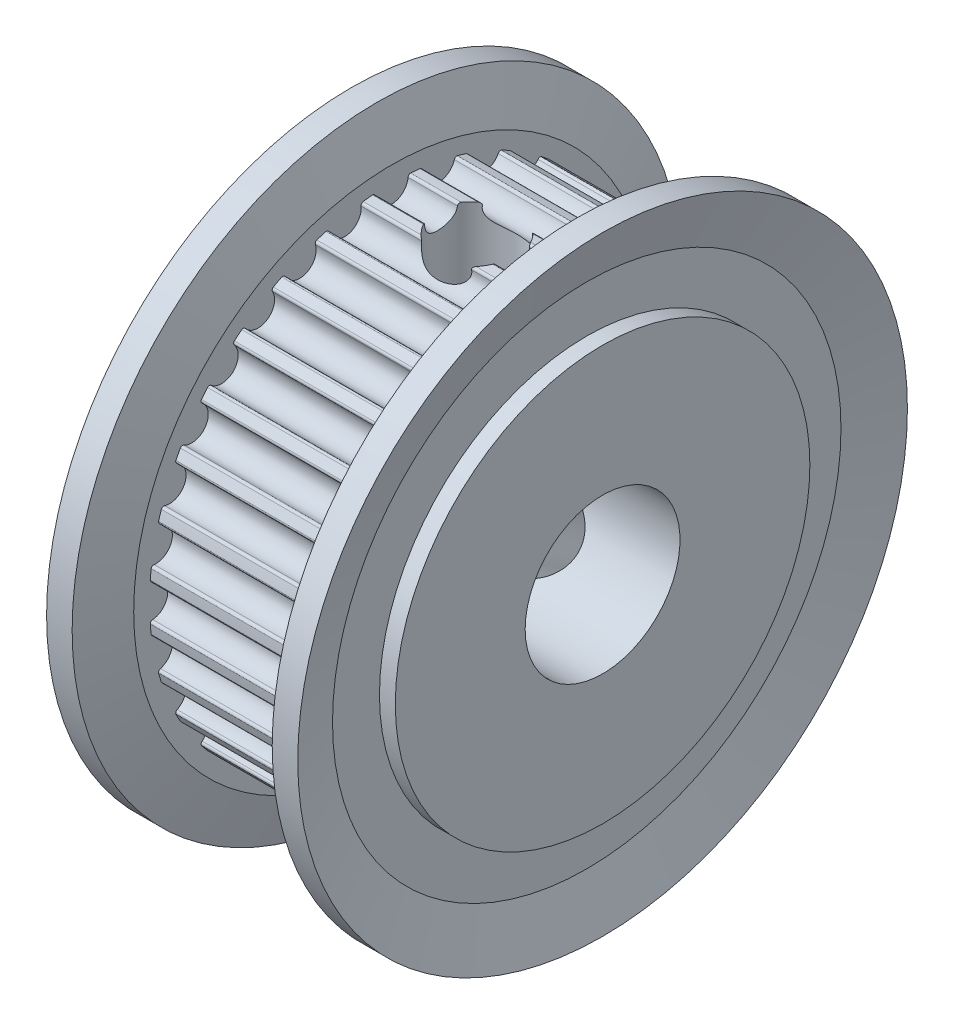
from build123d import *

# Parameters (mm, degrees)
CUT_EXTRUDE1_DEPTH       = 3.5
CUT_EXTRUDE1_DEPTH_BACK  = 3.5
CUT_EXTRUDE2_DEPTH       = 3.5
CUT_EXTRUDE2_DEPTH_BACK  = 3.5
CUT_EXTRUDE3_DEPTH       = 3.5
CUT_EXTRUDE3_DEPTH_BACK  = 3.5
CUT_EXTRUDE4_DEPTH       = 3.5
CUT_EXTRUDE4_DEPTH_BACK  = 3.5
CUT_EXTRUDE5_DEPTH       = 3.5
CUT_EXTRUDE5_DEPTH_BACK  = 3.5
CUT_EXTRUDE6_DEPTH       = 3.5
CUT_EXTRUDE6_DEPTH_BACK  = 3.5
CUT_EXTRUDE7_DEPTH       = 3.5
CUT_EXTRUDE7_DEPTH_BACK  = 3.5
CUT_EXTRUDE8_DEPTH       = 3.5
CUT_EXTRUDE8_DEPTH_BACK  = 3.5
CUT_EXTRUDE9_DEPTH       = 3.5
CUT_EXTRUDE9_DEPTH_BACK  = 3.5
CUT_EXTRUDE10_DEPTH      = 3.5
CUT_EXTRUDE10_DEPTH_BACK = 3.5
CUT_EXTRUDE11_DEPTH      = 3.5
CUT_EXTRUDE11_DEPTH_BACK = 3.5
CUT_EXTRUDE12_DEPTH      = 3.5
CUT_EXTRUDE12_DEPTH_BACK = 3.5
CUT_EXTRUDE13_DEPTH      = 3.5
CUT_EXTRUDE13_DEPTH_BACK = 3.5
CUT_EXTRUDE14_DEPTH      = 3.5
CUT_EXTRUDE14_DEPTH_BACK = 3.5
CUT_EXTRUDE15_DEPTH      = 3.5
CUT_EXTRUDE15_DEPTH_BACK = 3.5
CUT_EXTRUDE16_DEPTH      = 3.5
CUT_EXTRUDE16_DEPTH_BACK = 3.5
CUT_EXTRUDE17_DEPTH      = 3.5
CUT_EXTRUDE17_DEPTH_BACK = 3.5
CUT_EXTRUDE18_DEPTH      = 3.5
CUT_EXTRUDE18_DEPTH_BACK = 3.5
CUT_EXTRUDE19_DEPTH      = 3.5
CUT_EXTRUDE19_DEPTH_BACK = 3.5
CUT_EXTRUDE20_DEPTH      = 3.5
CUT_EXTRUDE20_DEPTH_BACK = 3.5
CUT_EXTRUDE21_DEPTH      = 3.5
CUT_EXTRUDE21_DEPTH_BACK = 3.5
CUT_EXTRUDE22_DEPTH      = 3.5
CUT_EXTRUDE22_DEPTH_BACK = 3.5
CUT_EXTRUDE23_DEPTH      = 3.5
CUT_EXTRUDE23_DEPTH_BACK = 3.5
CUT_EXTRUDE24_DEPTH      = 3.5
CUT_EXTRUDE24_DEPTH_BACK = 3.5
CUT_EXTRUDE25_DEPTH      = 3.5
CUT_EXTRUDE25_DEPTH_BACK = 3.5
CUT_EXTRUDE26_DEPTH      = 3.5
CUT_EXTRUDE26_DEPTH_BACK = 3.5
CUT_EXTRUDE27_DEPTH      = 3.5
CUT_EXTRUDE27_DEPTH_BACK = 3.5
CUT_EXTRUDE28_DEPTH      = 3.5
CUT_EXTRUDE28_DEPTH_BACK = 3.5
CUT_EXTRUDE29_DEPTH      = 3.5
CUT_EXTRUDE29_DEPTH_BACK = 3.5
CUT_EXTRUDE30_DEPTH      = 3.5
CUT_EXTRUDE30_DEPTH_BACK = 3.5
CUT_EXTRUDE31_DEPTH      = 3.5
CUT_EXTRUDE31_DEPTH_BACK = 3.5
CUT_EXTRUDE32_DEPTH      = 3.5
CUT_EXTRUDE32_DEPTH_BACK = 3.5
SKETCH36_W               = 10.3
SKETCH36_H               = 3.175
SKETCH37_W               = 1.621
SKETCH37_H               = 9.93


with BuildPart() as part:
    # Sketch1 → Revolve1 (revolve)
    with BuildSketch(Plane.XY, mode=Mode.PRIVATE) as revolve1_sk:
        Polygon((-5.15, 0), (-5.15, 8.5), (-3.5, 8.5), (-3.5, 9.93), (3.5, 9.93), (3.5, 8.5), (5.15, 8.5), (5.15, 0), align=None)
    revolve(revolve1_sk.sketch.rotate(Axis((5.15, 0, 0), (-1, 0, 0)), 270), axis=Axis((5.15, 0, 0), (-1, 0, 0)))

    # Sketch2 → Cut-Extrude1 (cut, two sides: drawn at the far end of the back side and taken through both)
    with BuildSketch(Plane(origin=(0, 0, 0), x_dir=(0, 0, -1), z_dir=(1, 0, 0)).offset(-CUT_EXTRUDE1_DEPTH_BACK)):
        with BuildLine():
            Line((-0.950908352, 10.140512724), (-0.927279331, 9.888532197))
            Line((-0.927279331, 9.888532197), (-0.792969158, 9.89929093))
            ThreePointArc((-0.792969158, 9.89929093), (-0.711706778, 9.873169891), (-0.672449407, 9.797375816))
            ThreePointArc((-0.672449407, 9.797375816), (-2e-09, 9.181), (0.672449407, 9.797375812))
            ThreePointArc((0.672449407, 9.797375812), (0.711706777, 9.87316989), (0.792969158, 9.89929093))
            Line((0.792969158, 9.89929093), (0.927279331, 9.888532197))
            Line((0.927279331, 9.888532197), (0.950908352, 10.140512724))
            ThreePointArc((0.950908352, 10.140512724), (0, 10.185), (-0.950908352, 10.140512724))
        make_face()
    extrude(amount=CUT_EXTRUDE1_DEPTH + CUT_EXTRUDE1_DEPTH_BACK, mode=Mode.SUBTRACT)

    # Sketch3 → Cut-Extrude2 (cut, two sides: drawn at the far end of the back side and taken through both)
    with BuildSketch(Plane(origin=(0, 0, 0), x_dir=(0, 0, -1), z_dir=(1, 0, 0)).offset(-CUT_EXTRUDE2_DEPTH_BACK)):
        with BuildLine():
            Line((-2.910952807, 9.760152599), (-2.838618849, 9.5176236))
            Line((-2.838618849, 9.5176236), (-2.708988333, 9.554378222))
            ThreePointArc((-2.708988333, 9.554378222), (-2.624191426, 9.544612596), (-2.570901683, 9.477933616))
            ThreePointArc((-2.570901683, 9.477933616), (-1.791124249, 9.004589659), (-1.251844722, 9.740310354))
            ThreePointArc((-1.251844722, 9.740310354), (-1.228128363, 9.822306803), (-1.153523377, 9.863779439))
            Line((-1.153523377, 9.863779439), (-1.019695012, 9.879430047))
            Line((-1.019695012, 9.879430047), (-1.045678978, 10.131178632))
            ThreePointArc((-1.045678978, 10.131178632), (-1.98699493, 9.989298081), (-2.910952807, 9.760152599))
        make_face()
    extrude(amount=CUT_EXTRUDE2_DEPTH + CUT_EXTRUDE2_DEPTH_BACK, mode=Mode.SUBTRACT)

    # Sketch4 → Cut-Extrude3 (cut, two sides: drawn at the far end of the back side and taken through both)
    with BuildSketch(Plane(origin=(0, 0, 0), x_dir=(0, 0, -1), z_dir=(1, 0, 0)).offset(-CUT_EXTRUDE3_DEPTH_BACK)):
        with BuildLine():
            Line((-4.759130979, 9.004715283), (-4.640871837, 8.780958066))
            Line((-4.640871837, 8.780958066), (-4.520902606, 8.842296117))
            ThreePointArc((-4.520902606, 8.842296117), (-4.435829868, 8.849261191), (-4.370555649, 8.794259742))
            ThreePointArc((-4.370555649, 8.794259742), (-3.513416595, 8.482137987), (-3.12803116, 9.308930232))
            ThreePointArc((-3.12803116, 9.308930232), (-3.120767218, 9.393977974), (-3.055686656, 9.449208436))
            Line((-3.055686656, 9.449208436), (-2.927483047, 9.490666941))
            Line((-2.927483047, 9.490666941), (-3.002081451, 9.732509027))
            ThreePointArc((-3.002081451, 9.732509027), (-3.897630759, 9.409713039), (-4.759130979, 9.004715283))
        make_face()
    extrude(amount=CUT_EXTRUDE3_DEPTH + CUT_EXTRUDE3_DEPTH_BACK, mode=Mode.SUBTRACT)

    # Sketch5 → Cut-Extrude4 (cut, two sides: drawn at the far end of the back side and taken through both)
    with BuildSketch(Plane(origin=(0, 0, 0), x_dir=(0, 0, -1), z_dir=(1, 0, 0)).offset(-CUT_EXTRUDE4_DEPTH_BACK)):
        with BuildLine():
            Line((-6.424418416, 7.903231808), (-6.264778723, 7.706845238))
            Line((-6.264778723, 7.706845238), (-6.159081127, 7.790409532))
            ThreePointArc((-6.159081127, 7.790409532), (-6.077001856, 7.813837641), (-6.002251613, 7.772627398))
            ThreePointArc((-6.002251613, 7.772627398), (-5.100690311, 7.633722509), (-4.884009115, 8.519813141))
            ThreePointArc((-4.884009115, 8.519813141), (-4.893476739, 8.60464384), (-4.84042161, 8.671509651))
            Line((-4.84042161, 8.671509651), (-4.722769551, 8.737182826))
            Line((-4.722769551, 8.737182826), (-4.843115618, 8.959824558))
            ThreePointArc((-4.843115618, 8.959824558), (-5.658482823, 8.468518001), (-6.424418416, 7.903231808))
        make_face()
    extrude(amount=CUT_EXTRUDE4_DEPTH + CUT_EXTRUDE4_DEPTH_BACK, mode=Mode.SUBTRACT)

    # Sketch6 → Cut-Extrude5 (cut, two sides: drawn at the far end of the back side and taken through both)
    with BuildSketch(Plane(origin=(0, 0, 0), x_dir=(0, 0, -1), z_dir=(1, 0, 0)).offset(-CUT_EXTRUDE5_DEPTH_BACK)):
        with BuildLine():
            Line((-7.842819056, 6.498031568), (-7.647933676, 6.33656267))
            Line((-7.647933676, 6.33656267), (-7.560569614, 6.439141876))
            ThreePointArc((-7.560569614, 6.439141876), (-7.484638071, 6.478132693), (-7.403284413, 6.452297342))
            ThreePointArc((-7.403284413, 6.452297342), (-6.49194736, 6.491947357), (-6.452297339, 7.40328441))
            ThreePointArc((-6.452297339, 7.40328441), (-6.478132693, 7.484638069), (-6.439141876, 7.560569614))
            Line((-6.439141876, 7.560569614), (-6.33656267, 7.647933676))
            Line((-6.33656267, 7.647933676), (-6.498031568, 7.842819056))
            ThreePointArc((-6.498031568, 7.842819056), (-7.201882566, 7.201882566), (-7.842819056, 6.498031568))
        make_face()
    extrude(amount=CUT_EXTRUDE5_DEPTH + CUT_EXTRUDE5_DEPTH_BACK, mode=Mode.SUBTRACT)

    # Sketch7 → Cut-Extrude6 (cut, two sides: drawn at the far end of the back side and taken through both)
    with BuildSketch(Plane(origin=(0, 0, 0), x_dir=(0, 0, -1), z_dir=(1, 0, 0)).offset(-CUT_EXTRUDE6_DEPTH_BACK)):
        with BuildLine():
            Line((-8.959824558, 4.843115618), (-8.737182826, 4.722769551))
            Line((-8.737182826, 4.722769551), (-8.671509651, 4.84042161))
            ThreePointArc((-8.671509651, 4.84042161), (-8.604643842, 4.893476738), (-8.519813145, 4.884009117))
            ThreePointArc((-8.519813145, 4.884009117), (-7.633722512, 5.100690308), (-7.772627394, 6.00225161))
            ThreePointArc((-7.772627394, 6.00225161), (-7.813837641, 6.077001854), (-7.790409532, 6.159081127))
            Line((-7.790409532, 6.159081127), (-7.706845238, 6.264778723))
            Line((-7.706845238, 6.264778723), (-7.903231808, 6.424418416))
            ThreePointArc((-7.903231808, 6.424418416), (-8.468518001, 5.658482823), (-8.959824558, 4.843115618))
        make_face()
    extrude(amount=CUT_EXTRUDE6_DEPTH + CUT_EXTRUDE6_DEPTH_BACK, mode=Mode.SUBTRACT)

    # Sketch8 → Cut-Extrude7 (cut, two sides: drawn at the far end of the back side and taken through both)
    with BuildSketch(Plane(origin=(0, 0, 0), x_dir=(0, 0, -1), z_dir=(1, 0, 0)).offset(-CUT_EXTRUDE7_DEPTH_BACK)):
        with BuildLine():
            Line((-9.732509027, 3.002081451), (-9.490666941, 2.927483047))
            Line((-9.490666941, 2.927483047), (-9.449208436, 3.055686656))
            ThreePointArc((-9.449208436, 3.055686656), (-9.393977976, 3.120767217), (-9.308930236, 3.128031162))
            ThreePointArc((-9.308930236, 3.128031162), (-8.482137989, 3.513416591), (-8.794259738, 4.370555647))
            ThreePointArc((-8.794259738, 4.370555647), (-8.84926119, 4.435829866), (-8.842296117, 4.520902606))
            Line((-8.842296117, 4.520902606), (-8.780958066, 4.640871837))
            Line((-8.780958066, 4.640871837), (-9.004715283, 4.759130979))
            ThreePointArc((-9.004715283, 4.759130979), (-9.409713039, 3.897630759), (-9.732509027, 3.002081451))
        make_face()
    extrude(amount=CUT_EXTRUDE7_DEPTH + CUT_EXTRUDE7_DEPTH_BACK, mode=Mode.SUBTRACT)

    # Sketch9 → Cut-Extrude8 (cut, two sides: drawn at the far end of the back side and taken through both)
    with BuildSketch(Plane(origin=(0, 0, 0), x_dir=(0, 0, -1), z_dir=(1, 0, 0)).offset(-CUT_EXTRUDE8_DEPTH_BACK)):
        with BuildLine():
            Line((-10.131178632, 1.045678978), (-9.879430047, 1.019695012))
            Line((-9.879430047, 1.019695012), (-9.863779439, 1.153523377))
            ThreePointArc((-9.863779439, 1.153523377), (-9.822306805, 1.228128361), (-9.740310358, 1.251844723))
            ThreePointArc((-9.740310358, 1.251844723), (-9.00458966, 1.791124244), (-9.477933611, 2.570901682))
            ThreePointArc((-9.477933611, 2.570901682), (-9.544612594, 2.624191424), (-9.554378222, 2.708988333))
            Line((-9.554378222, 2.708988333), (-9.5176236, 2.838618849))
            Line((-9.5176236, 2.838618849), (-9.760152599, 2.910952807))
            ThreePointArc((-9.760152599, 2.910952807), (-9.989298081, 1.98699493), (-10.131178632, 1.045678978))
        make_face()
    extrude(amount=CUT_EXTRUDE8_DEPTH + CUT_EXTRUDE8_DEPTH_BACK, mode=Mode.SUBTRACT)

    # Sketch10 → Cut-Extrude9 (cut, two sides: drawn at the far end of the back side and taken through both)
    with BuildSketch(Plane(origin=(0, 0, 0), x_dir=(0, 0, -1), z_dir=(1, 0, 0)).offset(-CUT_EXTRUDE9_DEPTH_BACK)):
        with BuildLine():
            Line((-10.140512724, -0.950908352), (-9.888532197, -0.927279331))
            Line((-9.888532197, -0.927279331), (-9.89929093, -0.792969158))
            ThreePointArc((-9.89929093, -0.792969158), (-9.873169891, -0.711706778), (-9.797375816, -0.672449407))
            ThreePointArc((-9.797375816, -0.672449407), (-9.181, -2e-09), (-9.797375812, 0.672449407))
            ThreePointArc((-9.797375812, 0.672449407), (-9.87316989, 0.711706777), (-9.89929093, 0.792969158))
            Line((-9.89929093, 0.792969158), (-9.888532197, 0.927279331))
            Line((-9.888532197, 0.927279331), (-10.140512724, 0.950908352))
            ThreePointArc((-10.140512724, 0.950908352), (-10.185, 0), (-10.140512724, -0.950908352))
        make_face()
    extrude(amount=CUT_EXTRUDE9_DEPTH + CUT_EXTRUDE9_DEPTH_BACK, mode=Mode.SUBTRACT)

    # Sketch11 → Cut-Extrude10 (cut, two sides: drawn at the far end of the back side and taken through both)
    with BuildSketch(Plane(origin=(0, 0, 0), x_dir=(0, 0, -1), z_dir=(1, 0, 0)).offset(-CUT_EXTRUDE10_DEPTH_BACK)):
        with BuildLine():
            Line((-9.760152599, -2.910952807), (-9.5176236, -2.838618849))
            Line((-9.5176236, -2.838618849), (-9.554378222, -2.708988333))
            ThreePointArc((-9.554378222, -2.708988333), (-9.544612596, -2.624191426), (-9.477933616, -2.570901683))
            ThreePointArc((-9.477933616, -2.570901683), (-9.004589659, -1.791124249), (-9.740310354, -1.251844722))
            ThreePointArc((-9.740310354, -1.251844722), (-9.822306803, -1.228128363), (-9.863779439, -1.153523377))
            Line((-9.863779439, -1.153523377), (-9.879430047, -1.019695012))
            Line((-9.879430047, -1.019695012), (-10.131178632, -1.045678978))
            ThreePointArc((-10.131178632, -1.045678978), (-9.989298081, -1.98699493), (-9.760152599, -2.910952807))
        make_face()
    extrude(amount=CUT_EXTRUDE10_DEPTH + CUT_EXTRUDE10_DEPTH_BACK, mode=Mode.SUBTRACT)

    # Sketch12 → Cut-Extrude11 (cut, two sides: drawn at the far end of the back side and taken through both)
    with BuildSketch(Plane(origin=(0, 0, 0), x_dir=(0, 0, -1), z_dir=(1, 0, 0)).offset(-CUT_EXTRUDE11_DEPTH_BACK)):
        with BuildLine():
            Line((-9.004715283, -4.759130979), (-8.780958066, -4.640871837))
            Line((-8.780958066, -4.640871837), (-8.842296117, -4.520902606))
            ThreePointArc((-8.842296117, -4.520902606), (-8.849261191, -4.435829868), (-8.794259742, -4.370555649))
            ThreePointArc((-8.794259742, -4.370555649), (-8.482137987, -3.513416595), (-9.308930232, -3.12803116))
            ThreePointArc((-9.308930232, -3.12803116), (-9.393977974, -3.120767218), (-9.449208436, -3.055686656))
            Line((-9.449208436, -3.055686656), (-9.490666941, -2.927483047))
            Line((-9.490666941, -2.927483047), (-9.732509027, -3.002081451))
            ThreePointArc((-9.732509027, -3.002081451), (-9.409713039, -3.897630759), (-9.004715283, -4.759130979))
        make_face()
    extrude(amount=CUT_EXTRUDE11_DEPTH + CUT_EXTRUDE11_DEPTH_BACK, mode=Mode.SUBTRACT)

    # Sketch13 → Cut-Extrude12 (cut, two sides: drawn at the far end of the back side and taken through both)
    with BuildSketch(Plane(origin=(0, 0, 0), x_dir=(0, 0, -1), z_dir=(1, 0, 0)).offset(-CUT_EXTRUDE12_DEPTH_BACK)):
        with BuildLine():
            Line((-7.903231808, -6.424418416), (-7.706845238, -6.264778723))
            Line((-7.706845238, -6.264778723), (-7.790409532, -6.159081127))
            ThreePointArc((-7.790409532, -6.159081127), (-7.813837641, -6.077001856), (-7.772627398, -6.002251613))
            ThreePointArc((-7.772627398, -6.002251613), (-7.633722509, -5.100690311), (-8.519813141, -4.884009115))
            ThreePointArc((-8.519813141, -4.884009115), (-8.60464384, -4.893476739), (-8.671509651, -4.84042161))
            Line((-8.671509651, -4.84042161), (-8.737182826, -4.722769551))
            Line((-8.737182826, -4.722769551), (-8.959824558, -4.843115618))
            ThreePointArc((-8.959824558, -4.843115618), (-8.468518001, -5.658482823), (-7.903231808, -6.424418416))
        make_face()
    extrude(amount=CUT_EXTRUDE12_DEPTH + CUT_EXTRUDE12_DEPTH_BACK, mode=Mode.SUBTRACT)

    # Sketch14 → Cut-Extrude13 (cut, two sides: drawn at the far end of the back side and taken through both)
    with BuildSketch(Plane(origin=(0, 0, 0), x_dir=(0, 0, -1), z_dir=(1, 0, 0)).offset(-CUT_EXTRUDE13_DEPTH_BACK)):
        with BuildLine():
            Line((-6.498031568, -7.842819056), (-6.33656267, -7.647933676))
            Line((-6.33656267, -7.647933676), (-6.439141876, -7.560569614))
            ThreePointArc((-6.439141876, -7.560569614), (-6.478132693, -7.484638071), (-6.452297342, -7.403284413))
            ThreePointArc((-6.452297342, -7.403284413), (-6.491947357, -6.49194736), (-7.40328441, -6.452297339))
            ThreePointArc((-7.40328441, -6.452297339), (-7.484638069, -6.478132693), (-7.560569614, -6.439141876))
            Line((-7.560569614, -6.439141876), (-7.647933676, -6.33656267))
            Line((-7.647933676, -6.33656267), (-7.842819056, -6.498031568))
            ThreePointArc((-7.842819056, -6.498031568), (-7.201882566, -7.201882566), (-6.498031568, -7.842819056))
        make_face()
    extrude(amount=CUT_EXTRUDE13_DEPTH + CUT_EXTRUDE13_DEPTH_BACK, mode=Mode.SUBTRACT)

    # Sketch15 → Cut-Extrude14 (cut, two sides: drawn at the far end of the back side and taken through both)
    with BuildSketch(Plane(origin=(0, 0, 0), x_dir=(0, 0, -1), z_dir=(1, 0, 0)).offset(-CUT_EXTRUDE14_DEPTH_BACK)):
        with BuildLine():
            Line((-4.843115618, -8.959824558), (-4.722769551, -8.737182826))
            Line((-4.722769551, -8.737182826), (-4.84042161, -8.671509651))
            ThreePointArc((-4.84042161, -8.671509651), (-4.893476738, -8.604643842), (-4.884009117, -8.519813145))
            ThreePointArc((-4.884009117, -8.519813145), (-5.100690308, -7.633722512), (-6.00225161, -7.772627394))
            ThreePointArc((-6.00225161, -7.772627394), (-6.077001854, -7.813837641), (-6.159081127, -7.790409532))
            Line((-6.159081127, -7.790409532), (-6.264778723, -7.706845238))
            Line((-6.264778723, -7.706845238), (-6.424418416, -7.903231808))
            ThreePointArc((-6.424418416, -7.903231808), (-5.658482823, -8.468518001), (-4.843115618, -8.959824558))
        make_face()
    extrude(amount=CUT_EXTRUDE14_DEPTH + CUT_EXTRUDE14_DEPTH_BACK, mode=Mode.SUBTRACT)

    # Sketch16 → Cut-Extrude15 (cut, two sides: drawn at the far end of the back side and taken through both)
    with BuildSketch(Plane(origin=(0, 0, 0), x_dir=(0, 0, -1), z_dir=(1, 0, 0)).offset(-CUT_EXTRUDE15_DEPTH_BACK)):
        with BuildLine():
            Line((-3.002081451, -9.732509027), (-2.927483047, -9.490666941))
            Line((-2.927483047, -9.490666941), (-3.055686656, -9.449208436))
            ThreePointArc((-3.055686656, -9.449208436), (-3.120767217, -9.393977976), (-3.128031162, -9.308930236))
            ThreePointArc((-3.128031162, -9.308930236), (-3.513416591, -8.482137989), (-4.370555647, -8.794259738))
            ThreePointArc((-4.370555647, -8.794259738), (-4.435829866, -8.84926119), (-4.520902606, -8.842296117))
            Line((-4.520902606, -8.842296117), (-4.640871837, -8.780958066))
            Line((-4.640871837, -8.780958066), (-4.759130979, -9.004715283))
            ThreePointArc((-4.759130979, -9.004715283), (-3.897630759, -9.409713039), (-3.002081451, -9.732509027))
        make_face()
    extrude(amount=CUT_EXTRUDE15_DEPTH + CUT_EXTRUDE15_DEPTH_BACK, mode=Mode.SUBTRACT)

    # Sketch17 → Cut-Extrude16 (cut, two sides: drawn at the far end of the back side and taken through both)
    with BuildSketch(Plane(origin=(0, 0, 0), x_dir=(0, 0, -1), z_dir=(1, 0, 0)).offset(-CUT_EXTRUDE16_DEPTH_BACK)):
        with BuildLine():
            Line((-1.045678978, -10.131178632), (-1.019695012, -9.879430047))
            Line((-1.019695012, -9.879430047), (-1.153523377, -9.863779439))
            ThreePointArc((-1.153523377, -9.863779439), (-1.228128361, -9.822306805), (-1.251844723, -9.740310358))
            ThreePointArc((-1.251844723, -9.740310358), (-1.791124244, -9.00458966), (-2.570901682, -9.477933611))
            ThreePointArc((-2.570901682, -9.477933611), (-2.624191424, -9.544612594), (-2.708988333, -9.554378222))
            Line((-2.708988333, -9.554378222), (-2.838618849, -9.5176236))
            Line((-2.838618849, -9.5176236), (-2.910952807, -9.760152599))
            ThreePointArc((-2.910952807, -9.760152599), (-1.98699493, -9.989298081), (-1.045678978, -10.131178632))
        make_face()
    extrude(amount=CUT_EXTRUDE16_DEPTH + CUT_EXTRUDE16_DEPTH_BACK, mode=Mode.SUBTRACT)

    # Sketch18 → Cut-Extrude17 (cut, two sides: drawn at the far end of the back side and taken through both)
    with BuildSketch(Plane(origin=(0, 0, 0), x_dir=(0, 0, -1), z_dir=(1, 0, 0)).offset(-CUT_EXTRUDE17_DEPTH_BACK)):
        with BuildLine():
            Line((0.950908352, -10.140512724), (0.927279331, -9.888532197))
            Line((0.927279331, -9.888532197), (0.792969158, -9.89929093))
            ThreePointArc((0.792969158, -9.89929093), (0.711706778, -9.873169891), (0.672449407, -9.797375816))
            ThreePointArc((0.672449407, -9.797375816), (2e-09, -9.181), (-0.672449407, -9.797375812))
            ThreePointArc((-0.672449407, -9.797375812), (-0.711706777, -9.87316989), (-0.792969158, -9.89929093))
            Line((-0.792969158, -9.89929093), (-0.927279331, -9.888532197))
            Line((-0.927279331, -9.888532197), (-0.950908352, -10.140512724))
            ThreePointArc((-0.950908352, -10.140512724), (0, -10.185), (0.950908352, -10.140512724))
        make_face()
    extrude(amount=CUT_EXTRUDE17_DEPTH + CUT_EXTRUDE17_DEPTH_BACK, mode=Mode.SUBTRACT)

    # Sketch19 → Cut-Extrude18 (cut, two sides: drawn at the far end of the back side and taken through both)
    with BuildSketch(Plane(origin=(0, 0, 0), x_dir=(0, 0, -1), z_dir=(1, 0, 0)).offset(-CUT_EXTRUDE18_DEPTH_BACK)):
        with BuildLine():
            Line((2.910952807, -9.760152599), (2.838618849, -9.5176236))
            Line((2.838618849, -9.5176236), (2.708988333, -9.554378222))
            ThreePointArc((2.708988333, -9.554378222), (2.624191426, -9.544612596), (2.570901683, -9.477933616))
            ThreePointArc((2.570901683, -9.477933616), (1.791124249, -9.004589659), (1.251844722, -9.740310354))
            ThreePointArc((1.251844722, -9.740310354), (1.228128363, -9.822306803), (1.153523377, -9.863779439))
            Line((1.153523377, -9.863779439), (1.019695012, -9.879430047))
            Line((1.019695012, -9.879430047), (1.045678978, -10.131178632))
            ThreePointArc((1.045678978, -10.131178632), (1.98699493, -9.989298081), (2.910952807, -9.760152599))
        make_face()
    extrude(amount=CUT_EXTRUDE18_DEPTH + CUT_EXTRUDE18_DEPTH_BACK, mode=Mode.SUBTRACT)

    # Sketch20 → Cut-Extrude19 (cut, two sides: drawn at the far end of the back side and taken through both)
    with BuildSketch(Plane(origin=(0, 0, 0), x_dir=(0, 0, -1), z_dir=(1, 0, 0)).offset(-CUT_EXTRUDE19_DEPTH_BACK)):
        with BuildLine():
            Line((4.759130979, -9.004715283), (4.640871837, -8.780958066))
            Line((4.640871837, -8.780958066), (4.520902606, -8.842296117))
            ThreePointArc((4.520902606, -8.842296117), (4.435829868, -8.849261191), (4.370555649, -8.794259742))
            ThreePointArc((4.370555649, -8.794259742), (3.513416595, -8.482137987), (3.12803116, -9.308930232))
            ThreePointArc((3.12803116, -9.308930232), (3.120767218, -9.393977974), (3.055686656, -9.449208436))
            Line((3.055686656, -9.449208436), (2.927483047, -9.490666941))
            Line((2.927483047, -9.490666941), (3.002081451, -9.732509027))
            ThreePointArc((3.002081451, -9.732509027), (3.897630759, -9.409713039), (4.759130979, -9.004715283))
        make_face()
    extrude(amount=CUT_EXTRUDE19_DEPTH + CUT_EXTRUDE19_DEPTH_BACK, mode=Mode.SUBTRACT)

    # Sketch21 → Cut-Extrude20 (cut, two sides: drawn at the far end of the back side and taken through both)
    with BuildSketch(Plane(origin=(0, 0, 0), x_dir=(0, 0, -1), z_dir=(1, 0, 0)).offset(-CUT_EXTRUDE20_DEPTH_BACK)):
        with BuildLine():
            Line((6.424418416, -7.903231808), (6.264778723, -7.706845238))
            Line((6.264778723, -7.706845238), (6.159081127, -7.790409532))
            ThreePointArc((6.159081127, -7.790409532), (6.077001856, -7.813837641), (6.002251613, -7.772627398))
            ThreePointArc((6.002251613, -7.772627398), (5.100690311, -7.633722509), (4.884009115, -8.519813141))
            ThreePointArc((4.884009115, -8.519813141), (4.893476739, -8.60464384), (4.84042161, -8.671509651))
            Line((4.84042161, -8.671509651), (4.722769551, -8.737182826))
            Line((4.722769551, -8.737182826), (4.843115618, -8.959824558))
            ThreePointArc((4.843115618, -8.959824558), (5.658482823, -8.468518001), (6.424418416, -7.903231808))
        make_face()
    extrude(amount=CUT_EXTRUDE20_DEPTH + CUT_EXTRUDE20_DEPTH_BACK, mode=Mode.SUBTRACT)

    # Sketch22 → Cut-Extrude21 (cut, two sides: drawn at the far end of the back side and taken through both)
    with BuildSketch(Plane(origin=(0, 0, 0), x_dir=(0, 0, -1), z_dir=(1, 0, 0)).offset(-CUT_EXTRUDE21_DEPTH_BACK)):
        with BuildLine():
            Line((7.842819056, -6.498031568), (7.647933676, -6.33656267))
            Line((7.647933676, -6.33656267), (7.560569614, -6.439141876))
            ThreePointArc((7.560569614, -6.439141876), (7.484638071, -6.478132693), (7.403284413, -6.452297342))
            ThreePointArc((7.403284413, -6.452297342), (6.49194736, -6.491947357), (6.452297339, -7.40328441))
            ThreePointArc((6.452297339, -7.40328441), (6.478132693, -7.484638069), (6.439141876, -7.560569614))
            Line((6.439141876, -7.560569614), (6.33656267, -7.647933676))
            Line((6.33656267, -7.647933676), (6.498031568, -7.842819056))
            ThreePointArc((6.498031568, -7.842819056), (7.201882566, -7.201882566), (7.842819056, -6.498031568))
        make_face()
    extrude(amount=CUT_EXTRUDE21_DEPTH + CUT_EXTRUDE21_DEPTH_BACK, mode=Mode.SUBTRACT)

    # Sketch23 → Cut-Extrude22 (cut, two sides: drawn at the far end of the back side and taken through both)
    with BuildSketch(Plane(origin=(0, 0, 0), x_dir=(0, 0, -1), z_dir=(1, 0, 0)).offset(-CUT_EXTRUDE22_DEPTH_BACK)):
        with BuildLine():
            Line((8.959824558, -4.843115618), (8.737182826, -4.722769551))
            Line((8.737182826, -4.722769551), (8.671509651, -4.84042161))
            ThreePointArc((8.671509651, -4.84042161), (8.604643842, -4.893476738), (8.519813145, -4.884009117))
            ThreePointArc((8.519813145, -4.884009117), (7.633722512, -5.100690308), (7.772627394, -6.00225161))
            ThreePointArc((7.772627394, -6.00225161), (7.813837641, -6.077001854), (7.790409532, -6.159081127))
            Line((7.790409532, -6.159081127), (7.706845238, -6.264778723))
            Line((7.706845238, -6.264778723), (7.903231808, -6.424418416))
            ThreePointArc((7.903231808, -6.424418416), (8.468518001, -5.658482823), (8.959824558, -4.843115618))
        make_face()
    extrude(amount=CUT_EXTRUDE22_DEPTH + CUT_EXTRUDE22_DEPTH_BACK, mode=Mode.SUBTRACT)

    # Sketch24 → Cut-Extrude23 (cut, two sides: drawn at the far end of the back side and taken through both)
    with BuildSketch(Plane(origin=(0, 0, 0), x_dir=(0, 0, -1), z_dir=(1, 0, 0)).offset(-CUT_EXTRUDE23_DEPTH_BACK)):
        with BuildLine():
            Line((9.732509027, -3.002081451), (9.490666941, -2.927483047))
            Line((9.490666941, -2.927483047), (9.449208436, -3.055686656))
            ThreePointArc((9.449208436, -3.055686656), (9.393977976, -3.120767217), (9.308930236, -3.128031162))
            ThreePointArc((9.308930236, -3.128031162), (8.482137989, -3.513416591), (8.794259738, -4.370555647))
            ThreePointArc((8.794259738, -4.370555647), (8.84926119, -4.435829866), (8.842296117, -4.520902606))
            Line((8.842296117, -4.520902606), (8.780958066, -4.640871837))
            Line((8.780958066, -4.640871837), (9.004715283, -4.759130979))
            ThreePointArc((9.004715283, -4.759130979), (9.409713039, -3.897630759), (9.732509027, -3.002081451))
        make_face()
    extrude(amount=CUT_EXTRUDE23_DEPTH + CUT_EXTRUDE23_DEPTH_BACK, mode=Mode.SUBTRACT)

    # Sketch25 → Cut-Extrude24 (cut, two sides: drawn at the far end of the back side and taken through both)
    with BuildSketch(Plane(origin=(0, 0, 0), x_dir=(0, 0, -1), z_dir=(1, 0, 0)).offset(-CUT_EXTRUDE24_DEPTH_BACK)):
        with BuildLine():
            Line((10.131178632, -1.045678978), (9.879430047, -1.019695012))
            Line((9.879430047, -1.019695012), (9.863779439, -1.153523377))
            ThreePointArc((9.863779439, -1.153523377), (9.822306805, -1.228128361), (9.740310358, -1.251844723))
            ThreePointArc((9.740310358, -1.251844723), (9.00458966, -1.791124244), (9.477933611, -2.570901682))
            ThreePointArc((9.477933611, -2.570901682), (9.544612594, -2.624191424), (9.554378222, -2.708988333))
            Line((9.554378222, -2.708988333), (9.5176236, -2.838618849))
            Line((9.5176236, -2.838618849), (9.760152599, -2.910952807))
            ThreePointArc((9.760152599, -2.910952807), (9.989298081, -1.98699493), (10.131178632, -1.045678978))
        make_face()
    extrude(amount=CUT_EXTRUDE24_DEPTH + CUT_EXTRUDE24_DEPTH_BACK, mode=Mode.SUBTRACT)

    # Sketch26 → Cut-Extrude25 (cut, two sides: drawn at the far end of the back side and taken through both)
    with BuildSketch(Plane(origin=(0, 0, 0), x_dir=(0, 0, -1), z_dir=(1, 0, 0)).offset(-CUT_EXTRUDE25_DEPTH_BACK)):
        with BuildLine():
            Line((10.140512724, 0.950908352), (9.888532197, 0.927279331))
            Line((9.888532197, 0.927279331), (9.89929093, 0.792969158))
            ThreePointArc((9.89929093, 0.792969158), (9.873169891, 0.711706778), (9.797375816, 0.672449407))
            ThreePointArc((9.797375816, 0.672449407), (9.181, 2e-09), (9.797375812, -0.672449407))
            ThreePointArc((9.797375812, -0.672449407), (9.87316989, -0.711706777), (9.89929093, -0.792969158))
            Line((9.89929093, -0.792969158), (9.888532197, -0.927279331))
            Line((9.888532197, -0.927279331), (10.140512724, -0.950908352))
            ThreePointArc((10.140512724, -0.950908352), (10.185, 0), (10.140512724, 0.950908352))
        make_face()
    extrude(amount=CUT_EXTRUDE25_DEPTH + CUT_EXTRUDE25_DEPTH_BACK, mode=Mode.SUBTRACT)

    # Sketch27 → Cut-Extrude26 (cut, two sides: drawn at the far end of the back side and taken through both)
    with BuildSketch(Plane(origin=(0, 0, 0), x_dir=(0, 0, -1), z_dir=(1, 0, 0)).offset(-CUT_EXTRUDE26_DEPTH_BACK)):
        with BuildLine():
            Line((9.760152599, 2.910952807), (9.5176236, 2.838618849))
            Line((9.5176236, 2.838618849), (9.554378222, 2.708988333))
            ThreePointArc((9.554378222, 2.708988333), (9.544612596, 2.624191426), (9.477933616, 2.570901683))
            ThreePointArc((9.477933616, 2.570901683), (9.004589659, 1.791124249), (9.740310354, 1.251844722))
            ThreePointArc((9.740310354, 1.251844722), (9.822306803, 1.228128363), (9.863779439, 1.153523377))
            Line((9.863779439, 1.153523377), (9.879430047, 1.019695012))
            Line((9.879430047, 1.019695012), (10.131178632, 1.045678978))
            ThreePointArc((10.131178632, 1.045678978), (9.989298081, 1.98699493), (9.760152599, 2.910952807))
        make_face()
    extrude(amount=CUT_EXTRUDE26_DEPTH + CUT_EXTRUDE26_DEPTH_BACK, mode=Mode.SUBTRACT)

    # Sketch28 → Cut-Extrude27 (cut, two sides: drawn at the far end of the back side and taken through both)
    with BuildSketch(Plane(origin=(0, 0, 0), x_dir=(0, 0, -1), z_dir=(1, 0, 0)).offset(-CUT_EXTRUDE27_DEPTH_BACK)):
        with BuildLine():
            Line((9.004715283, 4.759130979), (8.780958066, 4.640871837))
            Line((8.780958066, 4.640871837), (8.842296117, 4.520902606))
            ThreePointArc((8.842296117, 4.520902606), (8.849261191, 4.435829868), (8.794259742, 4.370555649))
            ThreePointArc((8.794259742, 4.370555649), (8.482137987, 3.513416595), (9.308930232, 3.12803116))
            ThreePointArc((9.308930232, 3.12803116), (9.393977974, 3.120767218), (9.449208436, 3.055686656))
            Line((9.449208436, 3.055686656), (9.490666941, 2.927483047))
            Line((9.490666941, 2.927483047), (9.732509027, 3.002081451))
            ThreePointArc((9.732509027, 3.002081451), (9.409713039, 3.897630759), (9.004715283, 4.759130979))
        make_face()
    extrude(amount=CUT_EXTRUDE27_DEPTH + CUT_EXTRUDE27_DEPTH_BACK, mode=Mode.SUBTRACT)

    # Sketch29 → Cut-Extrude28 (cut, two sides: drawn at the far end of the back side and taken through both)
    with BuildSketch(Plane(origin=(0, 0, 0), x_dir=(0, 0, -1), z_dir=(1, 0, 0)).offset(-CUT_EXTRUDE28_DEPTH_BACK)):
        with BuildLine():
            Line((7.903231808, 6.424418416), (7.706845238, 6.264778723))
            Line((7.706845238, 6.264778723), (7.790409532, 6.159081127))
            ThreePointArc((7.790409532, 6.159081127), (7.813837641, 6.077001856), (7.772627398, 6.002251613))
            ThreePointArc((7.772627398, 6.002251613), (7.633722509, 5.100690311), (8.519813141, 4.884009115))
            ThreePointArc((8.519813141, 4.884009115), (8.60464384, 4.893476739), (8.671509651, 4.84042161))
            Line((8.671509651, 4.84042161), (8.737182826, 4.722769551))
            Line((8.737182826, 4.722769551), (8.959824558, 4.843115618))
            ThreePointArc((8.959824558, 4.843115618), (8.468518001, 5.658482823), (7.903231808, 6.424418416))
        make_face()
    extrude(amount=CUT_EXTRUDE28_DEPTH + CUT_EXTRUDE28_DEPTH_BACK, mode=Mode.SUBTRACT)

    # Sketch30 → Cut-Extrude29 (cut, two sides: drawn at the far end of the back side and taken through both)
    with BuildSketch(Plane(origin=(0, 0, 0), x_dir=(0, 0, -1), z_dir=(1, 0, 0)).offset(-CUT_EXTRUDE29_DEPTH_BACK)):
        with BuildLine():
            Line((6.498031568, 7.842819056), (6.33656267, 7.647933676))
            Line((6.33656267, 7.647933676), (6.439141876, 7.560569614))
            ThreePointArc((6.439141876, 7.560569614), (6.478132693, 7.484638071), (6.452297342, 7.403284413))
            ThreePointArc((6.452297342, 7.403284413), (6.491947357, 6.49194736), (7.40328441, 6.452297339))
            ThreePointArc((7.40328441, 6.452297339), (7.484638069, 6.478132693), (7.560569614, 6.439141876))
            Line((7.560569614, 6.439141876), (7.647933676, 6.33656267))
            Line((7.647933676, 6.33656267), (7.842819056, 6.498031568))
            ThreePointArc((7.842819056, 6.498031568), (7.201882566, 7.201882566), (6.498031568, 7.842819056))
        make_face()
    extrude(amount=CUT_EXTRUDE29_DEPTH + CUT_EXTRUDE29_DEPTH_BACK, mode=Mode.SUBTRACT)

    # Sketch31 → Cut-Extrude30 (cut, two sides: drawn at the far end of the back side and taken through both)
    with BuildSketch(Plane(origin=(0, 0, 0), x_dir=(0, 0, -1), z_dir=(1, 0, 0)).offset(-CUT_EXTRUDE30_DEPTH_BACK)):
        with BuildLine():
            Line((4.843115618, 8.959824558), (4.722769551, 8.737182826))
            Line((4.722769551, 8.737182826), (4.84042161, 8.671509651))
            ThreePointArc((4.84042161, 8.671509651), (4.893476738, 8.604643842), (4.884009117, 8.519813145))
            ThreePointArc((4.884009117, 8.519813145), (5.100690308, 7.633722512), (6.00225161, 7.772627394))
            ThreePointArc((6.00225161, 7.772627394), (6.077001854, 7.813837641), (6.159081127, 7.790409532))
            Line((6.159081127, 7.790409532), (6.264778723, 7.706845238))
            Line((6.264778723, 7.706845238), (6.424418416, 7.903231808))
            ThreePointArc((6.424418416, 7.903231808), (5.658482823, 8.468518001), (4.843115618, 8.959824558))
        make_face()
    extrude(amount=CUT_EXTRUDE30_DEPTH + CUT_EXTRUDE30_DEPTH_BACK, mode=Mode.SUBTRACT)

    # Sketch32 → Cut-Extrude31 (cut, two sides: drawn at the far end of the back side and taken through both)
    with BuildSketch(Plane(origin=(0, 0, 0), x_dir=(0, 0, -1), z_dir=(1, 0, 0)).offset(-CUT_EXTRUDE31_DEPTH_BACK)):
        with BuildLine():
            Line((3.002081451, 9.732509027), (2.927483047, 9.490666941))
            Line((2.927483047, 9.490666941), (3.055686656, 9.449208436))
            ThreePointArc((3.055686656, 9.449208436), (3.120767217, 9.393977976), (3.128031162, 9.308930236))
            ThreePointArc((3.128031162, 9.308930236), (3.513416591, 8.482137989), (4.370555647, 8.794259738))
            ThreePointArc((4.370555647, 8.794259738), (4.435829866, 8.84926119), (4.520902606, 8.842296117))
            Line((4.520902606, 8.842296117), (4.640871837, 8.780958066))
            Line((4.640871837, 8.780958066), (4.759130979, 9.004715283))
            ThreePointArc((4.759130979, 9.004715283), (3.897630759, 9.409713039), (3.002081451, 9.732509027))
        make_face()
    extrude(amount=CUT_EXTRUDE31_DEPTH + CUT_EXTRUDE31_DEPTH_BACK, mode=Mode.SUBTRACT)

    # Sketch33 → Cut-Extrude32 (cut, two sides: drawn at the far end of the back side and taken through both)
    with BuildSketch(Plane(origin=(0, 0, 0), x_dir=(0, 0, -1), z_dir=(1, 0, 0)).offset(-CUT_EXTRUDE32_DEPTH_BACK)):
        with BuildLine():
            Line((1.045678978, 10.131178632), (1.019695012, 9.879430047))
            Line((1.019695012, 9.879430047), (1.153523377, 9.863779439))
            ThreePointArc((1.153523377, 9.863779439), (1.228128361, 9.822306805), (1.251844723, 9.740310358))
            ThreePointArc((1.251844723, 9.740310358), (1.791124244, 9.00458966), (2.570901682, 9.477933611))
            ThreePointArc((2.570901682, 9.477933611), (2.624191424, 9.544612594), (2.708988333, 9.554378222))
            Line((2.708988333, 9.554378222), (2.838618849, 9.5176236))
            Line((2.838618849, 9.5176236), (2.910952807, 9.760152599))
            ThreePointArc((2.910952807, 9.760152599), (1.98699493, 9.989298081), (1.045678978, 10.131178632))
        make_face()
    extrude(amount=CUT_EXTRUDE32_DEPTH + CUT_EXTRUDE32_DEPTH_BACK, mode=Mode.SUBTRACT)

    # Sketch34 → Revolve2 (revolve)
    with BuildSketch(Plane.XY, mode=Mode.PRIVATE) as revolve2_sk:
        Polygon((3.5, 8.5), (4.5, 8.5), (4.5, 10.425), (5.15, 12.5), (4.102084235, 12.5), (3.5, 10.577961864), align=None)
    revolve(revolve2_sk.sketch.rotate(Axis((50, 0, 0), (-1, 0, 0)), 270), axis=Axis((50, 0, 0), (-1, 0, 0)))

    # Sketch35 → Revolve3 (revolve)
    with BuildSketch(Plane.XY, mode=Mode.PRIVATE) as revolve3_sk:
        Polygon((-5.15, 12.5), (-4.5, 10.425), (-4.5, 8.5), (-3.5, 8.5), (-3.5, 10.577961864), (-4.102084235, 12.5), align=None)
    revolve(revolve3_sk.sketch.rotate(Axis((50, 0, 0), (-1, 0, 0)), 270), axis=Axis((50, 0, 0), (-1, 0, 0)))

    # Sketch36 → Cut-Revolve1 (revolve, cut)
    with BuildSketch(Plane.XY, mode=Mode.PRIVATE) as cut_revolve1_sk:
        with Locations((0, 1.5875)):
            Rectangle(SKETCH36_W, SKETCH36_H)
    revolve(cut_revolve1_sk.sketch.rotate(Axis((5.15, 0, 0), (-1, 0, 0)), 270), axis=Axis((5.15, 0, 0), (-1, 0, 0)), mode=Mode.SUBTRACT)

    # Sketch37 → Cut-Revolve2 (revolve, cut)
    with BuildSketch(Plane(origin=(0, 0, 0), x_dir=(0, 0, -1), z_dir=(1, 0, 0)), mode=Mode.PRIVATE) as cut_revolve2_sk:
        with Locations((0.8105, 4.965)):
            Rectangle(SKETCH37_W, SKETCH37_H)
    revolve(cut_revolve2_sk.sketch.rotate(Axis((0, 0, 0), (0, 1, 0)), 180), axis=Axis((0, 0, 0), (0, 1, 0)), mode=Mode.SUBTRACT)

    # Sketch38 → Cut-Revolve3 (revolve, cut)
    with BuildSketch(Plane(origin=(0, 0, 0), x_dir=(0, 0, -1), z_dir=(1, 0, 0)), mode=Mode.PRIVATE) as cut_revolve3_sk:
        Polygon((8.25649325, -5.516812414), (7.355913902, -6.864624655), (-0.900579348, -1.347812242), (0, 0), align=None)
    revolve(cut_revolve3_sk.sketch.rotate(Axis((0, 0, 0), (0, -0.5555702330196052, -0.8314696123025433)), 180), axis=Axis((0, 0, 0), (0, -0.5555702330196052, -0.8314696123025433)), mode=Mode.SUBTRACT)


solid = part.part
